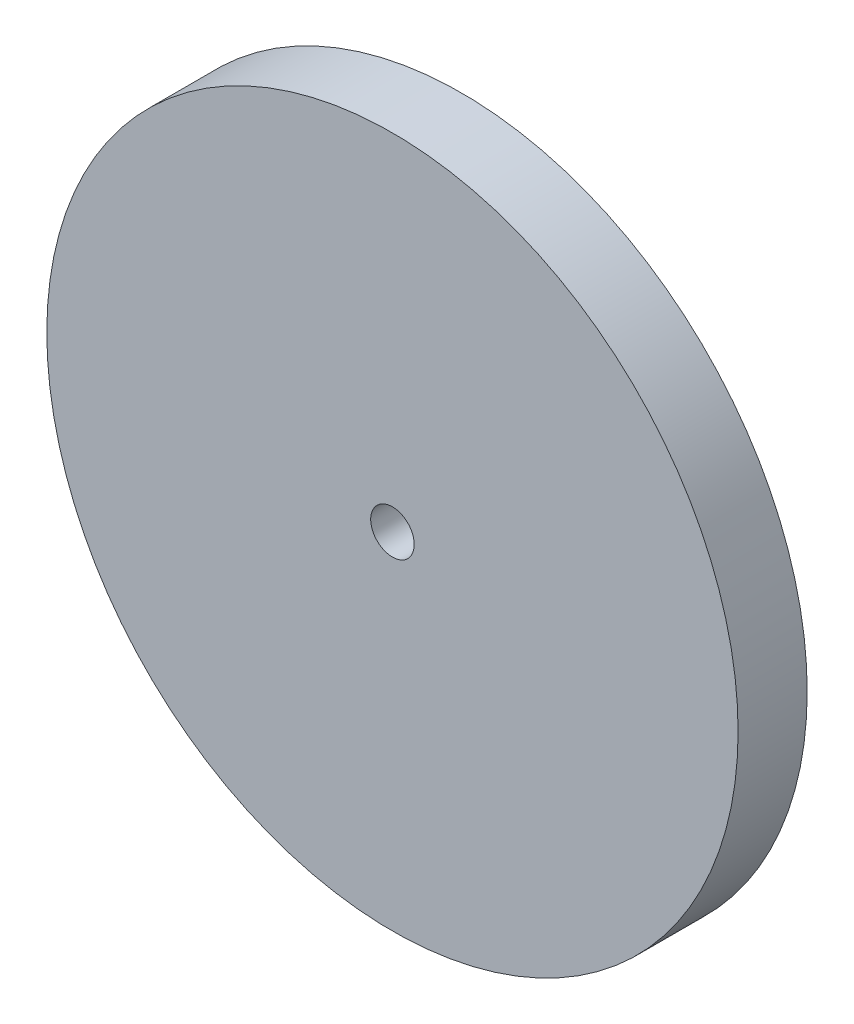
from build123d import *

# Parameters (mm, degrees)
SKETCH1_R           = 23.8252
BOSS_EXTRUDE1_DEPTH = 4.7625
SKETCH2_R           = 1.5
CUT_EXTRUDE1_DEPTH  = 35.028836541


with BuildPart() as part:
    # Sketch1 → Boss-Extrude1 (new body)
    with BuildSketch(Plane.XY):
        with Locations(Location((0, 0, 0), (0, 0, 180))):
            Circle(SKETCH1_R)
    extrude(amount=BOSS_EXTRUDE1_DEPTH)

    # Sketch2 → Cut-Extrude1 (cut, through all)
    with BuildSketch(Plane.XY.offset(4.7625)):
        Circle(SKETCH2_R)
    extrude(amount=-CUT_EXTRUDE1_DEPTH, mode=Mode.SUBTRACT)


solid = part.part
